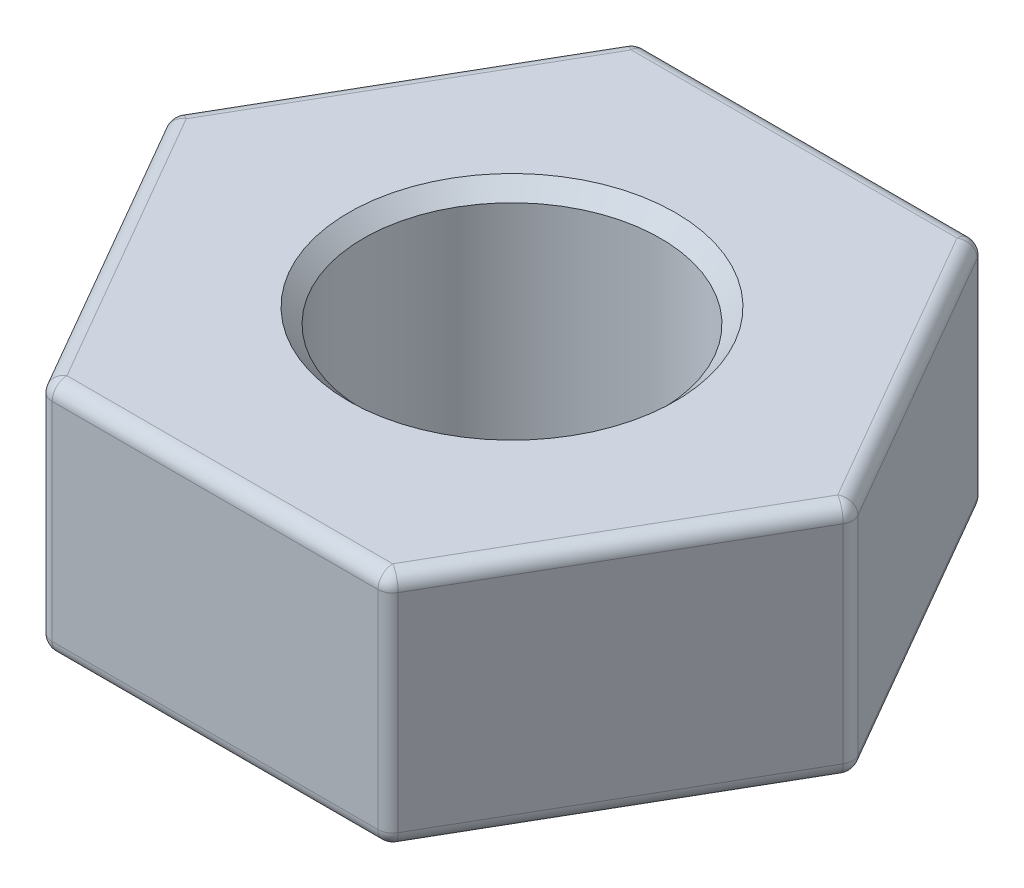
from build123d import *

# Parameters (mm, degrees)
SKETCH_2_R      = 1
EXTRUDE_1_DEPTH = 1.6
FILLET_1_R      = 0.1
CHAMFER_1_SIZE  = 0.1


with BuildPart() as part:
    # 草图2 → 凸台-拉伸1 (new body)
    with BuildSketch(Plane(origin=(0, 0, 0), x_dir=(1, 0, 0), z_dir=(0, 1, 0))):
        Polygon((2.309401077, 0), (1.154700538, 2), (-1.154700538, 2), (-2.309401077, 0), (-1.154700538, -2), (1.154700538, -2), align=None)
        with Locations(Location((0, 0, 0), (0, 0, 270))):
            Circle(SKETCH_2_R, mode=Mode.SUBTRACT)
    extrude(amount=EXTRUDE_1_DEPTH)

    # 圆角1
    fillet_1_edges = [part.edges().sort_by_distance(p)[0] for p in [
        (1.154700538, 0.8, 2),
        (-1.154700538, 0.8, 2),
        (-2.309401077, 0.8, 0),
        (-1.154700538, 0.8, -2),
        (1.154700538, 0.8, -2),
        (2.309401077, 0.8, 0),
        (0, 1.6, -2),
        (-1.732050808, 1.6, -1),
        (-1.732050808, 1.6, 1),
        (0, 1.6, 2),
        (1.732050808, 1.6, 1),
        (0, 0, 2),
        (-1.732050808, 0, 1),
        (-1.732050808, 0, -1),
        (0, 0, -2),
        (1.732050808, 0, -1),
        (1.732050808, 0, 1),
        (1.732050808, 1.6, -1),
    ]]
    fillet(fillet_1_edges, radius=FILLET_1_R)

    # 倒角1
    chamfer_1_edges = [part.edges().sort_by_distance(p)[0] for p in [
        (0, 0, -1),
        (0, 1.6, -1),
    ]]
    chamfer(chamfer_1_edges, length=CHAMFER_1_SIZE)


solid = part.part
